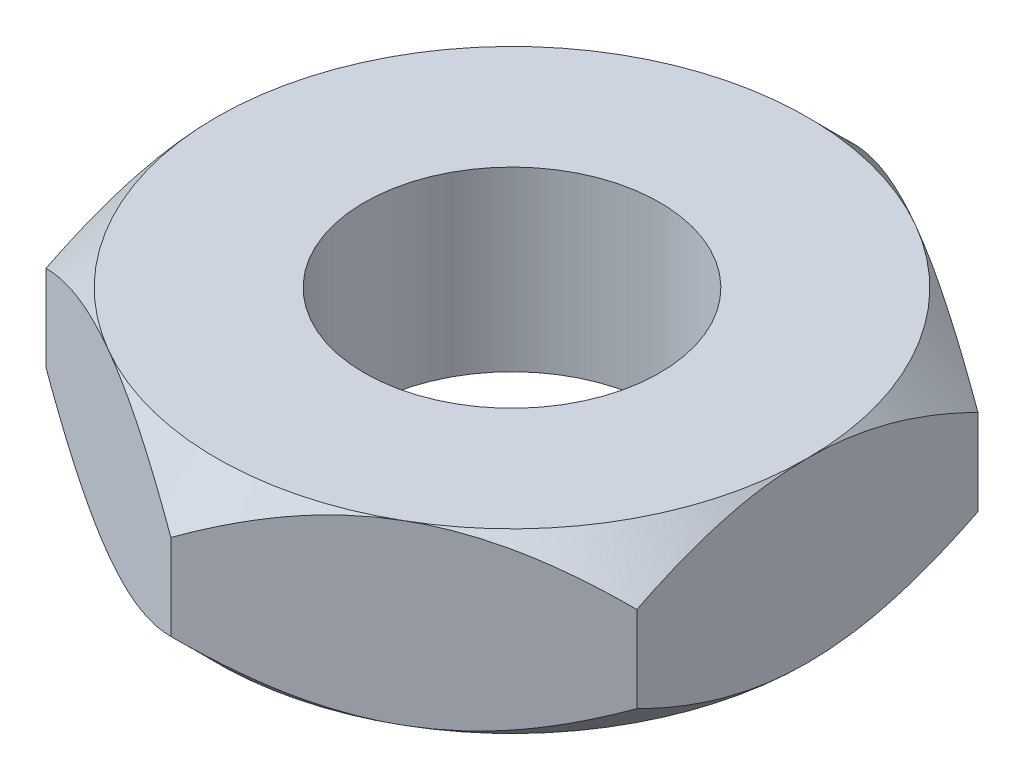
from build123d import *

# Parameters (mm, degrees)
SKETCH1_R           = 1
BOSS_EXTRUDE1_DEPTH = 0.6


with BuildPart() as part:
    # Sketch1 → Boss-Extrude1 (new, symmetric)
    with BuildSketch(Plane(origin=(0, 0, 0), x_dir=(1, 0, 0), z_dir=(0, 1, 0))):
        Polygon((0, 2.309401077), (-2, 1.154700538), (-2, -1.154700538), (0, -2.309401077), (2, -1.154700538), (2, 1.154700538), align=None)
        with Locations(Location((0, 0, 0), (0, 0, 270))):
            Circle(SKETCH1_R, mode=Mode.SUBTRACT)
    extrude(amount=BOSS_EXTRUDE1_DEPTH, both=True)

    # Cut-Sweep1: sweep along a path in Sketch2
    with BuildLine(Plane(origin=(0, 0.6, 0), x_dir=(1, 0, 0), z_dir=(0, 1, 0))) as cut_sweep1_path:
        CenterArc((0, 0), 2, 0, 360)
    # Sketch3 → Cut-Sweep1 (sweep, cut)
    with BuildSketch(Plane.XY):
        Polygon((-2.5, 0.1), (-2, 0.6), (-2.5, 0.6), align=None)
    cut_sweep1 = sweep(path=cut_sweep1_path.line, mode=Mode.SUBTRACT)

    # Mirror1: Cut-Sweep1 across plane
    add(cut_sweep1.mirror(Plane.ZX), mode=Mode.SUBTRACT)


solid = part.part
